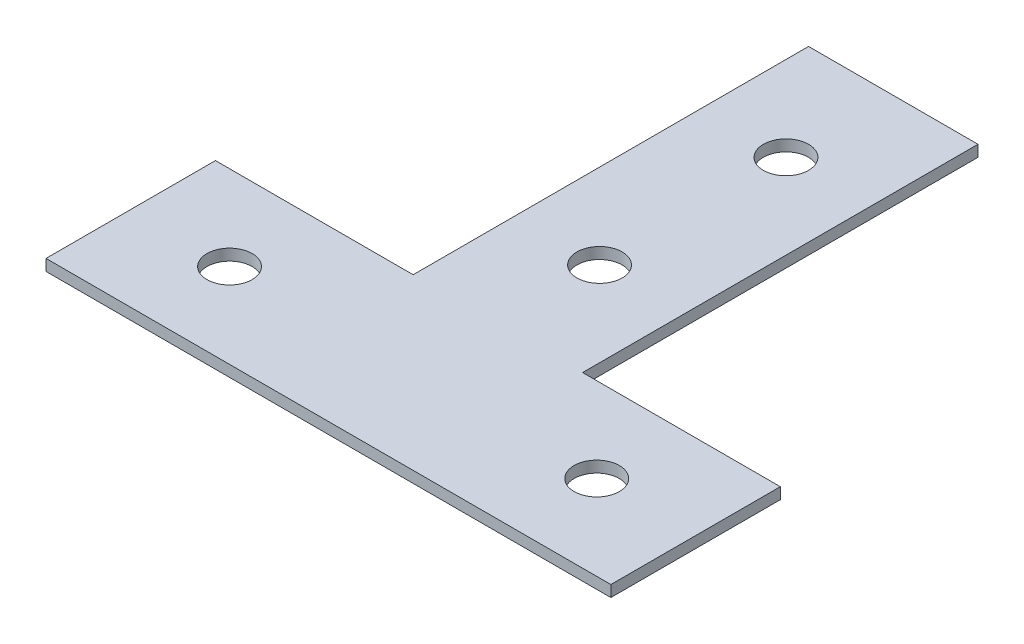
from build123d import *

# Parameters (mm, degrees)
BOSS_EXTRUDE1_DEPTH     = 1
CUT_EXTRUDE1_DEPTH      = 71.717748833
CUT_EXTRUDE1_DEPTH_BACK = 71.717748833
SKETCH2_R               = 2


with BuildPart() as part:
    # Sketch1 → Boss-Extrude1 (new body)
    with BuildSketch(Plane(origin=(0, 0, 0), x_dir=(1, 0, 0), z_dir=(0, 1, 0))):
        Polygon((17.5, 50), (32.5, 50), (32.5, 15), (50, 15), (50, 0), (0, 0), (0, 15), (17.5, 15), align=None)
    extrude(amount=BOSS_EXTRUDE1_DEPTH)

    # Sketch2 → Cut-Extrude1 (cut, two sides: drawn at the far end of the back side and taken through both)
    with BuildSketch(Plane(origin=(0, 1, 0), x_dir=(1, 0, 0), z_dir=(0, 1, 0)).offset(-CUT_EXTRUDE1_DEPTH_BACK)):
        with Locations(Location((41.25, 7.5, 0), (0, 0, 270))):
            Circle(SKETCH2_R)
        with Locations(Location((25, 40.5, 0), (0, 0, 270))):
            Circle(SKETCH2_R)
        with Locations(Location((25, 24, 0), (0, 0, 270))):
            Circle(SKETCH2_R)
        with Locations(Location((8.75, 7.5, 0), (0, 0, 270))):
            Circle(SKETCH2_R)
    extrude(amount=CUT_EXTRUDE1_DEPTH + CUT_EXTRUDE1_DEPTH_BACK, mode=Mode.SUBTRACT)


solid = part.part
